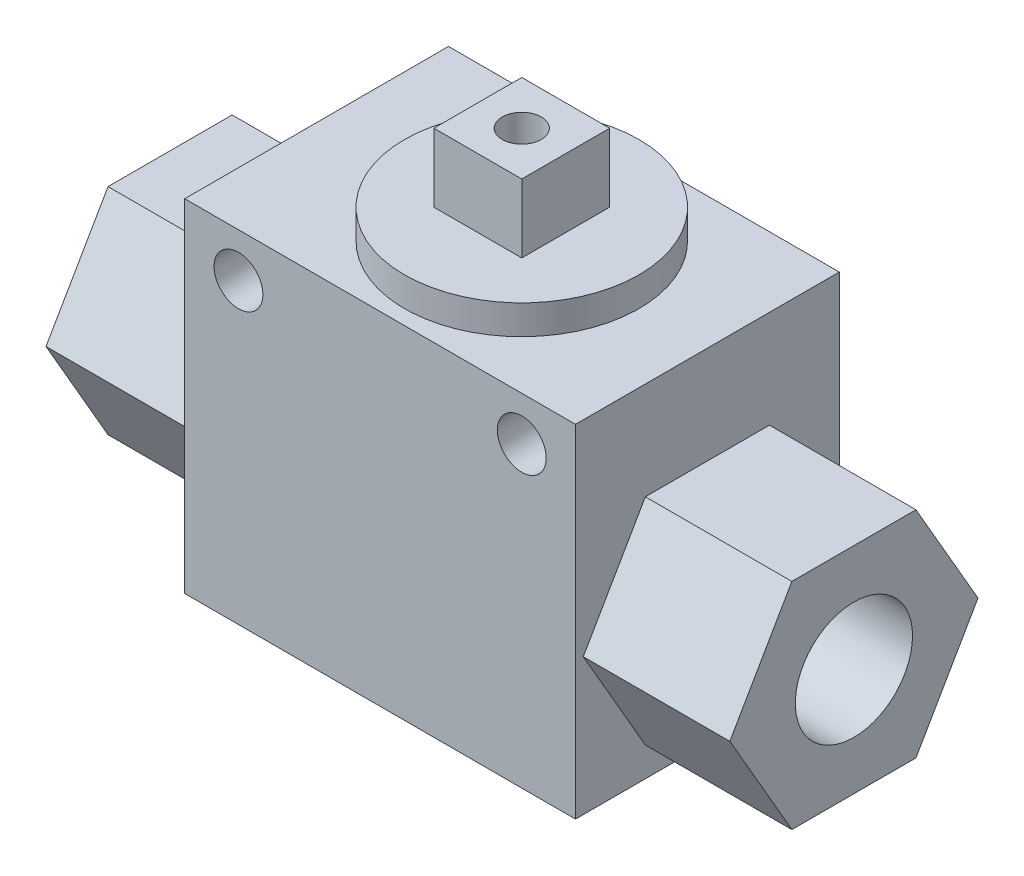
from build123d import *

# Parameters (mm, degrees)
DODANIE_WYCI_GNI_CIE1_DEPTH      = 13.5
DODANIE_WYCI_GNI_CIE1_DEPTH_BACK = 13.5
SZKIC2_R                         = 6
DODANIE_WYCI_GNI_CIE2_DEPTH      = 15
WYTNIJ_WYCI_GNI_CIE2_DEPTH       = 40
DODANIE_WYCI_GNI_CIE3_START      = -55
SZKIC2_6_R                       = 6
DODANIE_WYCI_GNI_CIE3_DEPTH      = 15
DODANIE_WYCI_GNI_CIE4_START      = 35
DODANIE_WYCI_GNI_CIE4_DEPTH      = 3
DODANIE_WYCI_GNI_CIE5_START      = 35
SZKIC3_3_W                       = 9
SZKIC3_3_H                       = 9
SZKIC3_3_R                       = 2
DODANIE_WYCI_GNI_CIE5_DEPTH      = 10


with BuildPart() as part:
    # Szkic1 → Dodanie-wyciągnięcie1 (new, two sides: drawn at the far end of the back side and taken through both)
    with BuildSketch(Plane.XY.offset(-DODANIE_WYCI_GNI_CIE1_DEPTH_BACK)):
        Polygon((40, 35), (0, 35), (0, 33), (0, 0), (40, 0), (40, 33), align=None)
        with BuildLine():
            ThreePointArc((8, 30.5), (3.732233047, 28.732233047), (5.5, 33))
            ThreePointArc((5.5, 33), (7.267766953, 32.267766953), (8, 30.5))
        make_face(mode=Mode.SUBTRACT)
        with BuildLine():
            ThreePointArc((37, 30.5), (32.732233047, 28.732233047), (34.5, 33))
            ThreePointArc((34.5, 33), (36.267766953, 32.267766953), (37, 30.5))
        make_face(mode=Mode.SUBTRACT)
    extrude(amount=DODANIE_WYCI_GNI_CIE1_DEPTH + DODANIE_WYCI_GNI_CIE1_DEPTH_BACK)

    # Szkic2 → Dodanie-wyciągnięcie2 (add)
    with BuildSketch(Plane(origin=(40, 0, 0), x_dir=(0, 0, -1), z_dir=(1, 0, 0))):
        Polygon((6.350852961, 3), (12.701705922, 14), (6.350852961, 25), (-6.350852961, 25), (-12.701705922, 14), (-6.350852961, 3), (1.5e-08, 3), align=None)
        with Locations((0, 14)):
            Circle(SZKIC2_R, mode=Mode.SUBTRACT)
    extrude(amount=DODANIE_WYCI_GNI_CIE2_DEPTH)

    # Szkic2<4> → Wytnij-wyciągnięcie2 (cut)
    with BuildSketch(Plane(origin=(40, 0, 0), x_dir=(0, 0, -1), z_dir=(1, 0, 0))):
        with BuildLine():
            ThreePointArc((3, 14), (-2.121320344, 16.121320344), (0, 11))
            ThreePointArc((0, 11), (2.121320344, 11.878679656), (3, 14))
        make_face()
    extrude(amount=-WYTNIJ_WYCI_GNI_CIE2_DEPTH, mode=Mode.SUBTRACT)

    # Szkic2<6> → Dodanie-wyciągnięcie3 (add)
    with BuildSketch(Plane(origin=(40, 0, 0), x_dir=(0, 0, -1), z_dir=(1, 0, 0)).offset(DODANIE_WYCI_GNI_CIE3_START)):
        Polygon((6.350852961, 3), (12.701705922, 14), (6.350852961, 25), (-6.350852961, 25), (-12.701705922, 14), (-6.350852961, 3), (1.5e-08, 3), align=None)
        with Locations((0, 14)):
            Circle(SZKIC2_6_R, mode=Mode.SUBTRACT)
    extrude(amount=DODANIE_WYCI_GNI_CIE3_DEPTH)

    # Szkic3 → Dodanie-wyciągnięcie4 (add)
    with BuildSketch(Plane(origin=(0, 0, 0), x_dir=(1, 0, 0), z_dir=(0, 1, 0)).offset(DODANIE_WYCI_GNI_CIE4_START)):
        with BuildLine():
            ThreePointArc((33, 0), (21, 12), (9, 0))
            ThreePointArc((9, 0), (21, -12), (33, 0))
        make_face()
        Polygon((16.5, -4.5), (16.5, 0), (16.5, 4.5), (25.5, 4.5), (25.5, 0), (25.5, -4.5), align=None, mode=Mode.SUBTRACT)
    extrude(amount=DODANIE_WYCI_GNI_CIE4_DEPTH)

    # Szkic3<3> → Dodanie-wyciągnięcie5 (add)
    with BuildSketch(Plane(origin=(0, 0, 0), x_dir=(1, 0, 0), z_dir=(0, 1, 0)).offset(DODANIE_WYCI_GNI_CIE5_START)):
        with Locations((21, 0)):
            Rectangle(SZKIC3_3_W, SZKIC3_3_H)
        with Locations((21, 0)):
            Circle(SZKIC3_3_R, mode=Mode.SUBTRACT)
    extrude(amount=DODANIE_WYCI_GNI_CIE5_DEPTH)


solid = part.part
